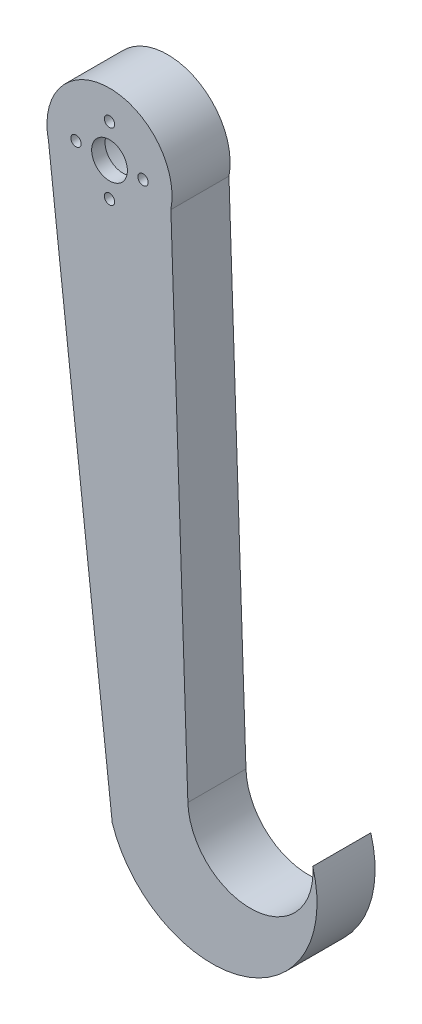
from build123d import *

# Parameters (mm, degrees)
SKETCH_1_R          = 14
EXTRUDE_1_DEPTH     = 13
SKETCH_2_R          = 10.6
CUT_EXTRUDE_1_DEPTH = 10
SKETCH_3_R          = 4
CUT_EXTRUDE_2_DEPTH = 10
EXTRUDE_START       = -13
EXTRUDE_3_DEPTH     = 13
SKETCH_7_R          = 1.15
CUT_EXTRUDE_3_DEPTH = 14


with BuildPart() as part:
    # 스케치1 → 보스-돌출1 (new body)
    with BuildSketch(Plane.XY):
        with Locations(Location((0, 0, 0), (0, 0, 180))):
            Circle(SKETCH_1_R)
    extrude(amount=EXTRUDE_1_DEPTH)

    # 스케치2 → 컷-돌출1 (cut)
    with BuildSketch(Plane(origin=(0, 0, 0), x_dir=(-1, 0, 0), z_dir=(0, 0, -1))):
        Circle(SKETCH_2_R)
    extrude(amount=-CUT_EXTRUDE_1_DEPTH, mode=Mode.SUBTRACT)

    # 스케치3 → 컷-돌출2 (cut)
    with BuildSketch(Plane.XY.offset(13)):
        Circle(SKETCH_3_R)
    extrude(amount=-CUT_EXTRUDE_2_DEPTH, mode=Mode.SUBTRACT)

    # 스케치6 → 보스-돌출3 (add)
    with BuildSketch(Plane.XY.offset(13).offset(EXTRUDE_START)):
        with BuildLine():
            Line((13.735578357, -2.708115061), (17.539668143, -115.708115061))
            ThreePointArc((17.539668143, -115.708115061), (32.332669837, -129.214149758), (45.486033392, -114.10670459))
            ThreePointArc((45.486033392, -114.10670459), (29.938586036, -143.187708961), (0.608578272, -128.115264599))
            Line((0.608578272, -128.115264599), (-13.64899727, -3.115264599))
            ThreePointArc((-13.64899727, -3.115264599), (0.208126783, -13.998452887), (13.735578357, -2.708115061))
        make_face()
    extrude(amount=EXTRUDE_3_DEPTH)

    # 스케치7 → 컷-돌출3 (cut)
    with BuildSketch(Plane(origin=(0, 0, 10), x_dir=(-1, 0, 0), z_dir=(0, 0, -1))):
        with Locations((7.5, 0)):
            Circle(SKETCH_7_R)
        with Locations((0, -7.5)):
            Circle(SKETCH_7_R)
        with Locations((-7.5, 0)):
            Circle(SKETCH_7_R)
        with Locations((0, 7.5)):
            Circle(SKETCH_7_R)
    extrude(amount=-CUT_EXTRUDE_3_DEPTH, mode=Mode.SUBTRACT)


solid = part.part
